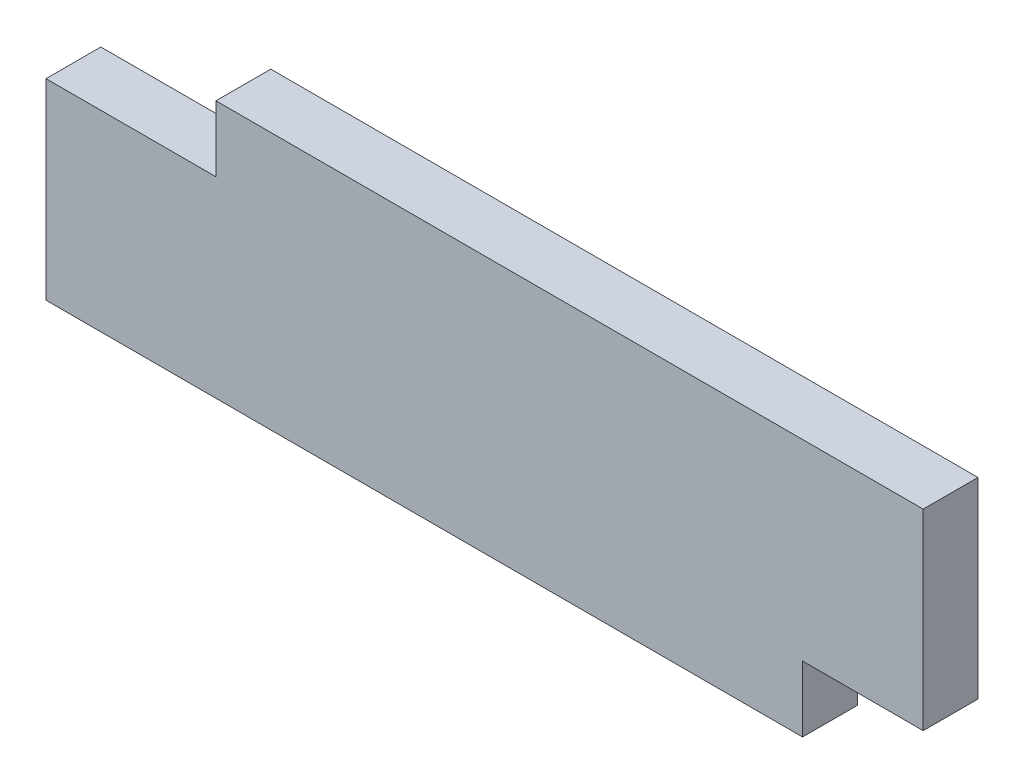
from build123d import *

# Parameters (mm, degrees)
SKETCH1_W           = 160
SKETCH1_H           = 47
BOSS_EXTRUDE1_DEPTH = 10
SKETCH3_W           = 31
SKETCH3_H           = 12
SKETCH3_W_2         = 22
CUT_EXTRUDE1_DEPTH  = 10


with BuildPart() as part:
    # Sketch1 → Boss-Extrude1 (new body)
    with BuildSketch(Plane.XY):
        with Locations((-50, 0)):
            Rectangle(SKETCH1_W, SKETCH1_H)
    extrude(amount=BOSS_EXTRUDE1_DEPTH)

    # Sketch3 → Cut-Extrude1 (cut)
    with BuildSketch(Plane(origin=(0, 0, 0), x_dir=(-1, 0, 0), z_dir=(0, 0, -1))):
        with Locations((114.5, 17.5)):
            Rectangle(SKETCH3_W, SKETCH3_H)
        with Locations((-19, -17.5)):
            Rectangle(SKETCH3_W_2, SKETCH3_H)
    extrude(amount=-CUT_EXTRUDE1_DEPTH, mode=Mode.SUBTRACT)


solid = part.part
